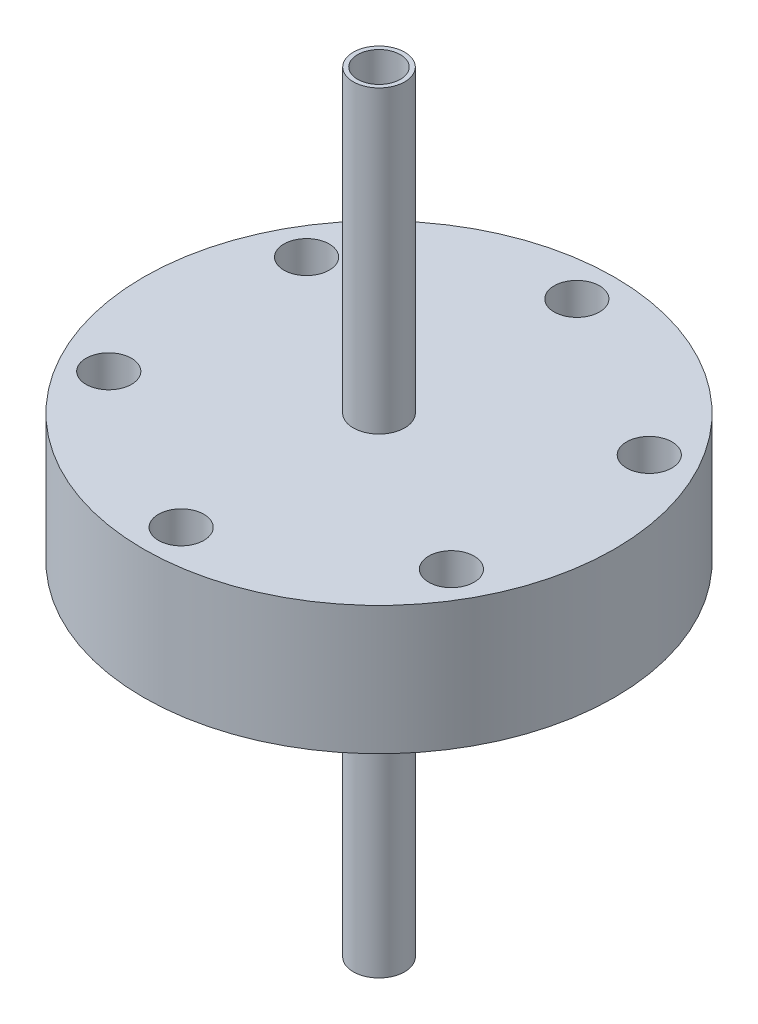
from build123d import *

# Parameters (mm, degrees)
SKETCH1_R                = 34.925
EXTRUDE1_DEPTH           = 19.05
SKETCH2_R                = 3.175
CUT_EXTRUDE1_DEPTH       = 53.937829102
SKETCH3_R                = 3.3655
CUT_EXTRUDE2_DEPTH       = 53.937829102
CIRPATTERN1_COUNT        = 6
EXTRUDE_THIN1_DEPTH      = 50.8
EXTRUDE_THIN1_DEPTH_BACK = 63.5
SKETCH5_R                = 3.81
SKETCH5_R_2              = 3.175


with BuildPart() as part:
    # Sketch1 → Extrude1 (new body)
    with BuildSketch(Plane(origin=(0, 0, 0), x_dir=(1, 0, 0), z_dir=(0, 1, 0))):
        Circle(SKETCH1_R)
    extrude(amount=EXTRUDE1_DEPTH)

    # Sketch2 → Cut-Extrude1 (cut, through all)
    with BuildSketch(Plane(origin=(0, 0, 0), x_dir=(1, 0, 0), z_dir=(0, 1, 0))):
        Circle(SKETCH2_R)
    extrude(amount=CUT_EXTRUDE1_DEPTH, mode=Mode.SUBTRACT)

    # Sketch3 → Cut-Extrude2 (cut, through all)
    with BuildSketch(Plane(origin=(0, 0, 0), x_dir=(1, 0, 0), z_dir=(0, 1, 0))):
        with Locations((0, 29.337)):
            Circle(SKETCH3_R)
    cut_extrude2 = extrude(amount=CUT_EXTRUDE2_DEPTH, mode=Mode.SUBTRACT)

    # CirPattern1: Cut-Extrude2 ×6 about axis
    cirpattern1_axis = Axis((0, 35.858162691, 0), (0, -1, 0))
    for i in range(1, CIRPATTERN1_COUNT):
        add(cut_extrude2.rotate(cirpattern1_axis, i * 360 / CIRPATTERN1_COUNT), mode=Mode.SUBTRACT)

    # Sketch5 → Extrude-Thin1 (add, two sides: drawn at the far end of the back side and taken through both)
    with BuildSketch(Plane.XZ.offset(-EXTRUDE_THIN1_DEPTH_BACK)):
        Circle(SKETCH5_R)
        Circle(SKETCH5_R_2, mode=Mode.SUBTRACT)
    extrude(amount=EXTRUDE_THIN1_DEPTH + EXTRUDE_THIN1_DEPTH_BACK)


solid = part.part
